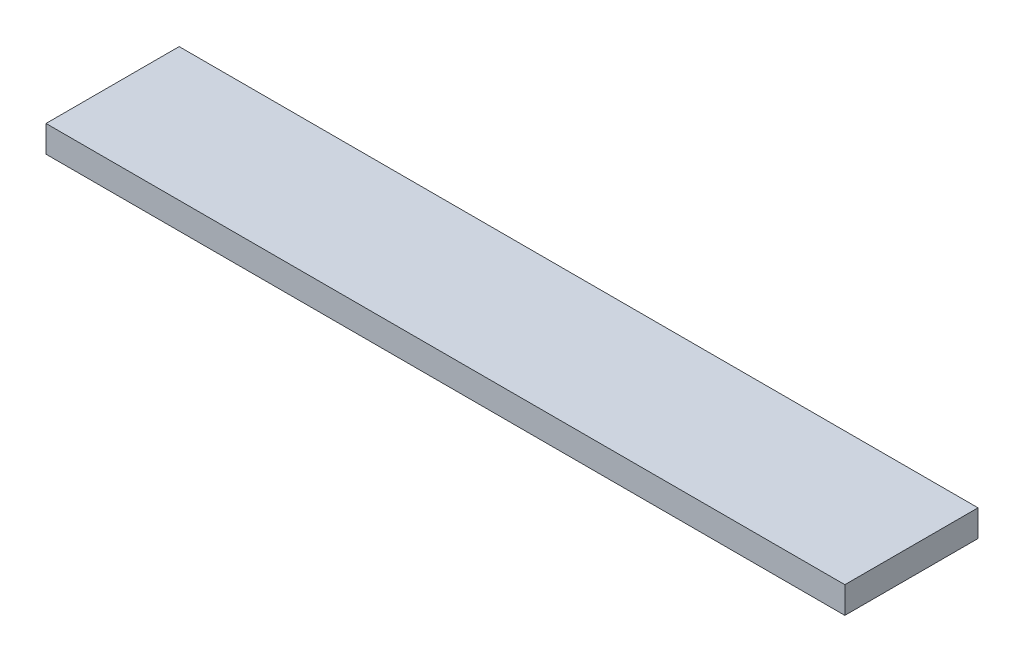
from build123d import *

# Parameters (mm, degrees)
SKETCH1_W           = 300
SKETCH1_H           = 50
BOSS_EXTRUDE1_DEPTH = 10


with BuildPart() as part:
    # Sketch1 → Boss-Extrude1 (new body)
    with BuildSketch(Plane(origin=(0, 0, 0), x_dir=(1, 0, 0), z_dir=(0, 1, 0))):
        Rectangle(SKETCH1_W, SKETCH1_H)
    extrude(amount=BOSS_EXTRUDE1_DEPTH)


solid = part.part
